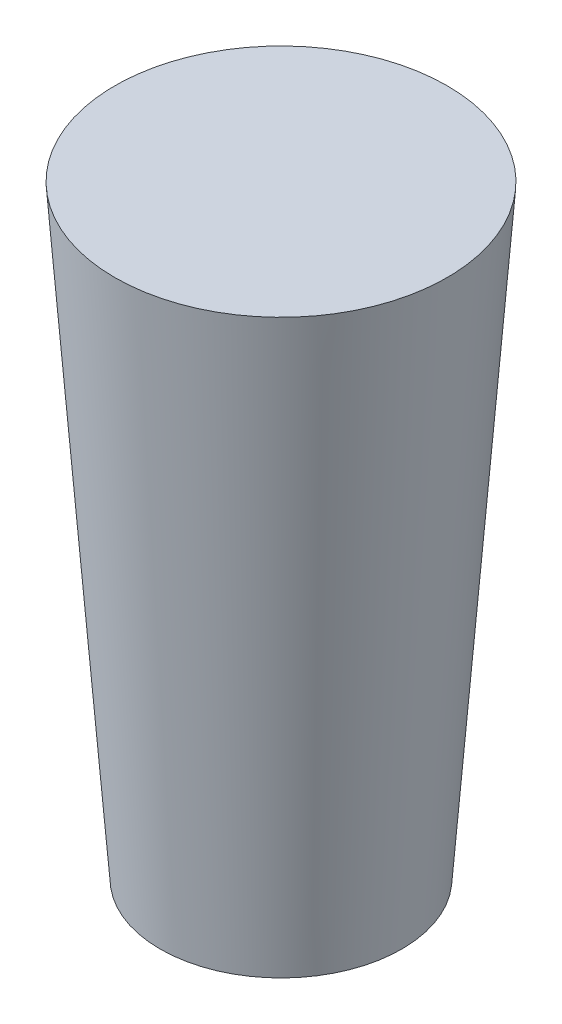
from build123d import *


with BuildPart() as part:
    # Sketch1 → Revolve1 (revolve)
    with BuildSketch(Plane.XY, mode=Mode.PRIVATE) as revolve1_sk:
        Polygon((-0.756353022, 14.955357143), (4.743646978, 14.955357143), (3.243646978, -5.044642857), (-0.756353022, -5.044642857), align=None)
    revolve(revolve1_sk.sketch.rotate(Axis((-0.756353022, 26.830357143, 0), (0, -1, 0)), 90), axis=Axis((-0.756353022, 26.830357143, 0), (0, -1, 0)))


solid = part.part
